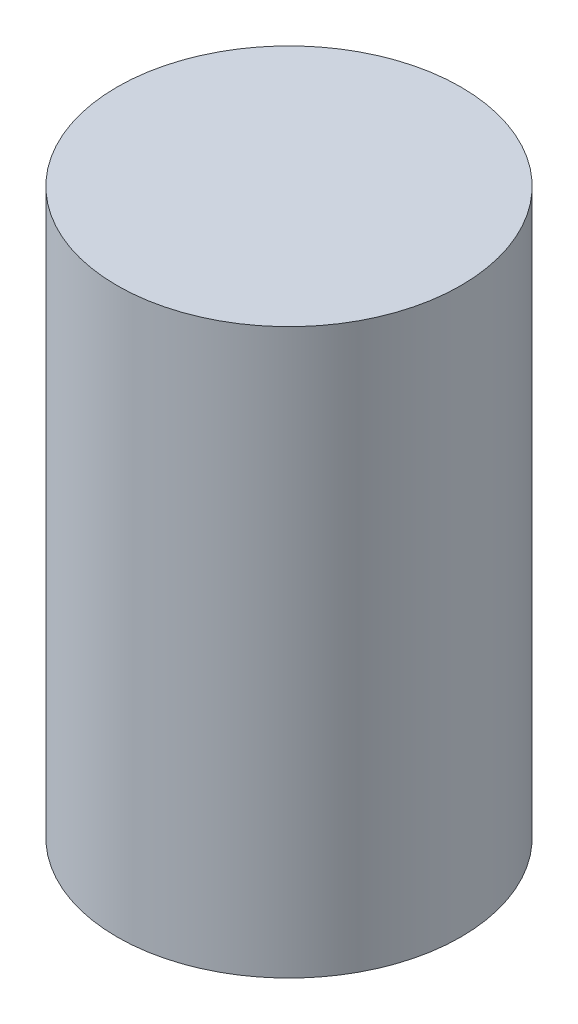
from build123d import *

# Parameters (mm, degrees)
SKETCH2_R           = 76.2
BOSS_EXTRUDE1_DEPTH = 250


with BuildPart() as part:
    # Sketch2 → Boss-Extrude1 (new body)
    with BuildSketch(Plane(origin=(0, 0, 0), x_dir=(1, 0, 0), z_dir=(0, 1, 0))):
        with Locations(Location((0, 0, 0), (0, 0, 270))):
            Circle(SKETCH2_R)
    extrude(amount=BOSS_EXTRUDE1_DEPTH)


solid = part.part
